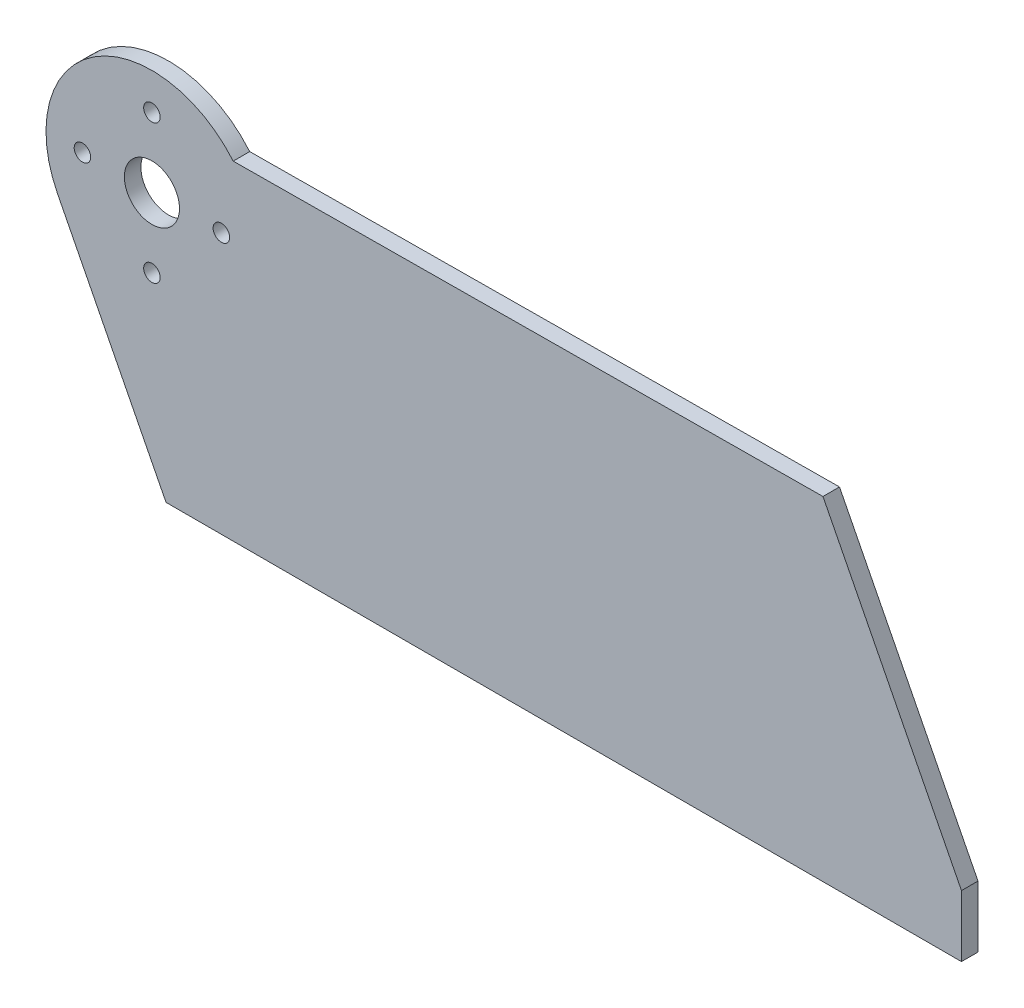
from build123d import *

# Parameters (mm, degrees)
SKETCH1_R           = 5
SKETCH1_R_2         = 1.5
BOSS_EXTRUDE1_DEPTH = 3


with BuildPart() as part:
    # Sketch1 → Boss-Extrude1 (new body)
    with BuildSketch(Plane.XY):
        with BuildLine():
            Line((121.815327096, 13.144873556), (146.959411549, -36.24203935))
            Line((146.959411549, -36.24203935), (146.959411549, -47.411715326))
            Line((146.959411549, -47.411715326), (2.561732102, -47.411715326))
            Line((2.561732102, -47.411715326), (-17.136179556, -8.72517889))
            ThreePointArc((-17.136179556, -8.72517889), (-10.596670935, 16.046431426), (14.753160039, 12.333761198))
            Line((14.753160039, 12.333761198), (121.815327096, 13.144873556))
        make_face()
        Circle(SKETCH1_R, mode=Mode.SUBTRACT)
        with Locations((12.609500958, 0)):
            Circle(SKETCH1_R_2, mode=Mode.SUBTRACT)
        with Locations((0, -12.609500958)):
            Circle(SKETCH1_R_2, mode=Mode.SUBTRACT)
        with Locations((-12.609500958, 0)):
            Circle(SKETCH1_R_2, mode=Mode.SUBTRACT)
        with Locations((0, 12.609500958)):
            Circle(SKETCH1_R_2, mode=Mode.SUBTRACT)
    extrude(amount=BOSS_EXTRUDE1_DEPTH)


solid = part.part
